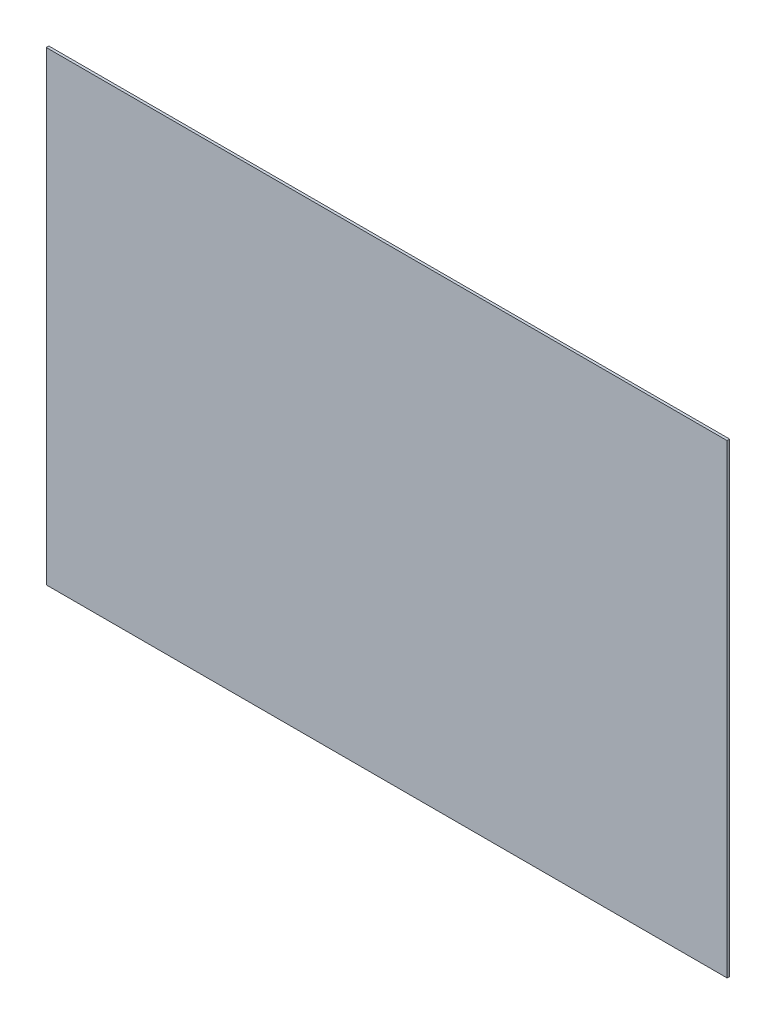
from build123d import *

# Parameters (mm, degrees)
SKETCH1_W           = 790
SKETCH1_H           = 540
BOSS_EXTRUDE1_DEPTH = 3


with BuildPart() as part:
    # Sketch1 → Boss-Extrude1 (new body)
    with BuildSketch(Plane.XY):
        Rectangle(SKETCH1_W, SKETCH1_H)
    extrude(amount=BOSS_EXTRUDE1_DEPTH)


solid = part.part
